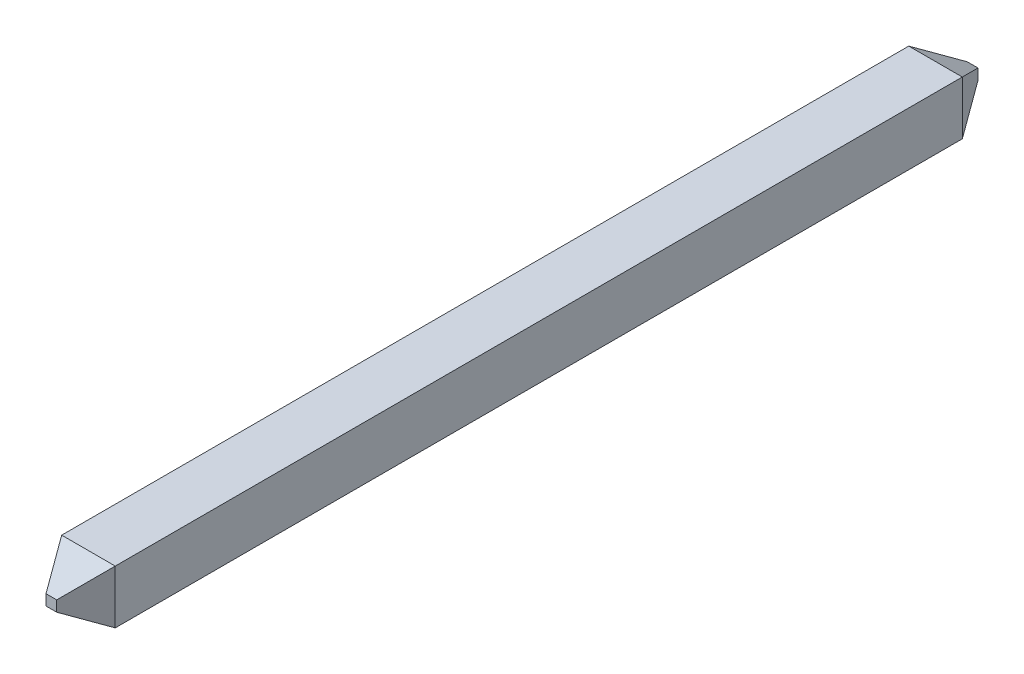
from build123d import *

# Parameters (mm, degrees)
SKETCH1_W           = 0.635
SKETCH1_H           = 0.635
BOSS_EXTRUDE1_DEPTH = 10.922
CHAMFER1_SIZE       = 0.254
CHAMFER1_SIZE2      = 0.439940905
CHAMFER2_SIZE       = 0.254
CHAMFER2_SIZE2      = 0.439940905


with BuildPart() as part:
    # Sketch1 → Boss-Extrude1 (new body)
    with BuildSketch(Plane.XY):
        Rectangle(SKETCH1_W, SKETCH1_H)
    extrude(amount=BOSS_EXTRUDE1_DEPTH)

    # Chamfer1
    chamfer1_edges = [part.edges().sort_by_distance(p)[0] for p in [
        (-0.3175, 0, 10.922),
        (0, 0.3175, 10.922),
        (0.3175, 0, 10.922),
        (0, -0.3175, 10.922),
    ]]
    chamfer1_side = [part.faces().sort_by_distance(p)[0] for p in [
        (0, 0, 10.922),
    ]]
    chamfer(chamfer1_edges, length=CHAMFER1_SIZE, length2=CHAMFER1_SIZE2, reference=chamfer1_side[0])

    # Chamfer2
    chamfer2_edges = [part.edges().sort_by_distance(p)[0] for p in [
        (0, -0.3175, 0),
        (-0.3175, 0, 0),
        (0, 0.3175, 0),
        (0.3175, 0, 0),
    ]]
    chamfer2_side = [part.faces().sort_by_distance(p)[0] for p in [
        (0, 0, 0),
    ]]
    chamfer(chamfer2_edges, length=CHAMFER2_SIZE, length2=CHAMFER2_SIZE2, reference=chamfer2_side[0])


solid = part.part
